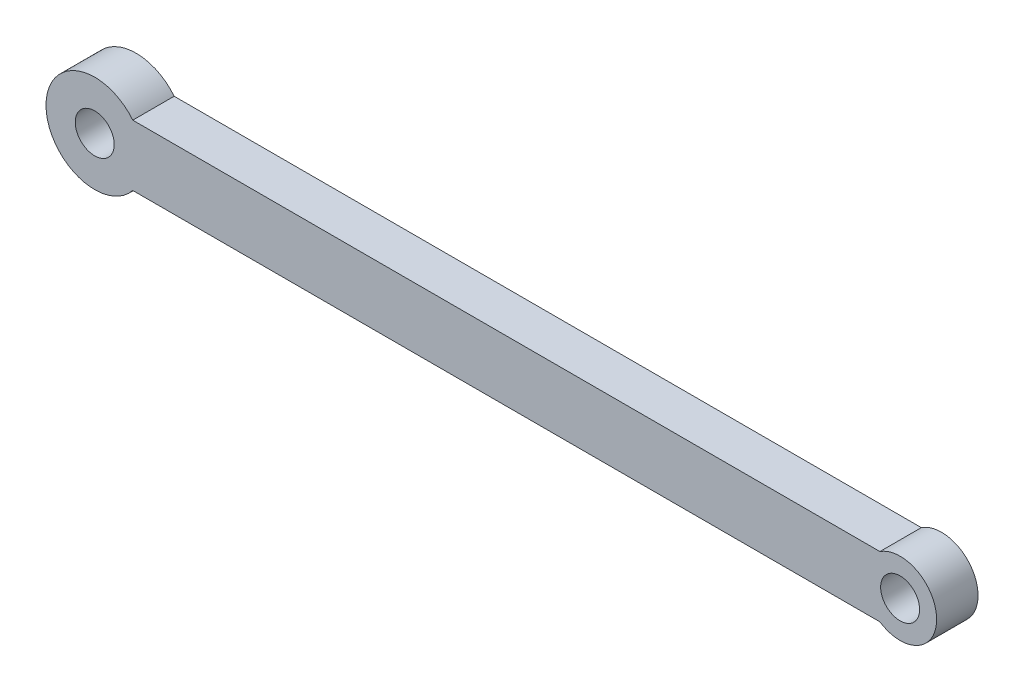
from build123d import *

# Parameters (mm, degrees)
ESQUISSE1_R        = 1.6
BOSS_EXTRU_1_DEPTH = 3.4


with BuildPart() as part:
    # Esquisse1 → Boss.-Extru.1 (new body)
    with BuildSketch(Plane.XY):
        with BuildLine():
            Line((3.122498999, 2.5), (64.461687605, 2.5))
            ThreePointArc((64.461687605, 2.5), (69.12, 0), (64.461687605, -2.5))
            Line((64.461687605, -2.5), (3.122498999, -2.5))
            ThreePointArc((3.122498999, -2.5), (-4, 0), (3.122498999, 2.5))
        make_face()
        Circle(ESQUISSE1_R, mode=Mode.SUBTRACT)
        with Locations((66.12, 0)):
            Circle(ESQUISSE1_R, mode=Mode.SUBTRACT)
    extrude(amount=BOSS_EXTRU_1_DEPTH)


solid = part.part
